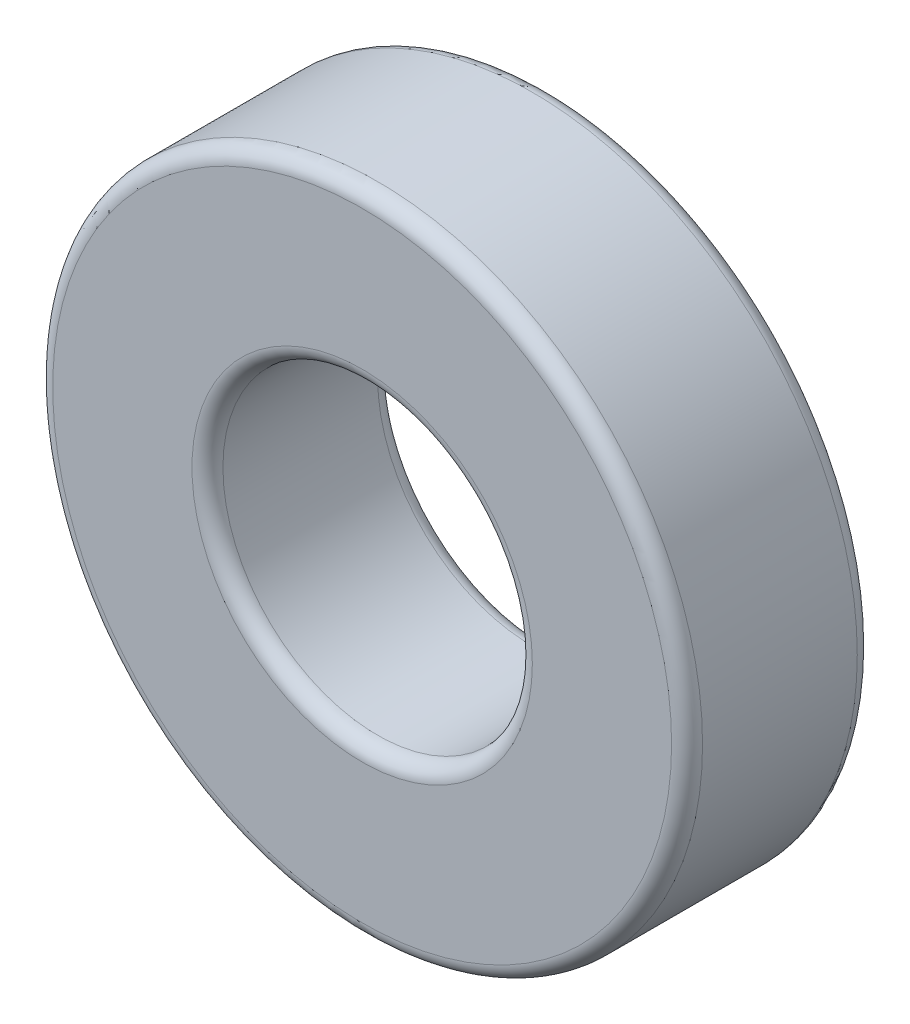
from build123d import *

# Parameters (mm, degrees)
BEARING_DIMENSIONS_R   = 21
BEARING_DIMENSIONS_R_2 = 10
BEARING_EXTRUDE_DEPTH  = 6
FILLET1_R              = 1


with BuildPart() as part:
    # Bearing Dimensions → Bearing Extrude (new, symmetric)
    with BuildSketch(Plane.XY):
        Circle(BEARING_DIMENSIONS_R)
        Circle(BEARING_DIMENSIONS_R_2, mode=Mode.SUBTRACT)
    extrude(amount=BEARING_EXTRUDE_DEPTH, both=True)

    # Fillet1
    fillet1_edges = [part.edges().sort_by_distance(p)[0] for p in [
        (-21, 0, -6),
        (-21, 0, 6),
        (-10, 0, -6),
        (-10, 0, 6),
    ]]
    fillet(fillet1_edges, radius=FILLET1_R)


solid = part.part
